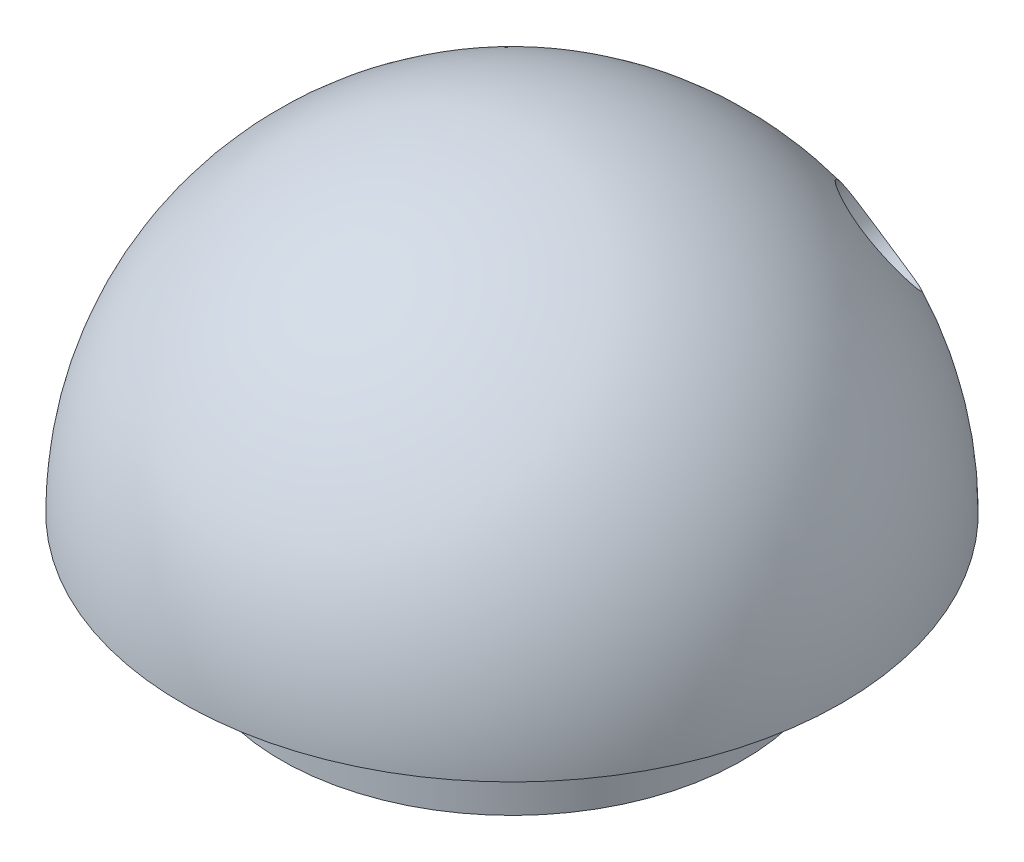
from build123d import *

# Parameters (mm, degrees)
SKETCH2_R          = 3.75
CUT_EXTRUDE1_DEPTH = 500


with BuildPart() as part:
    # Sketch1 → Revolve1 (revolve)
    with BuildSketch(Plane.XY, mode=Mode.PRIVATE) as revolve1_sk:
        with BuildLine():
            Line((17.5, 0), (17.5, 7.5))
            Line((17.5, 7.5), (25, 7.5))
            ThreePointArc((25, 7.5), (17.67766953, 25.17766953), (0, 32.5))
            Line((0, 32.5), (0, 30))
            ThreePointArc((0, 30), (15, 24.270509831), (22.360679775, 10))
            Line((22.360679775, 10), (15, 10))
            Line((15, 10), (15, 0))
            Line((15, 0), (17.5, 0))
        make_face()
    revolve(revolve1_sk.sketch.rotate(Axis((0, 0, 0), (0, 1, 0)), 90), axis=Axis((0, 0, 0), (0, 1, 0)))

    # Sketch2 → Cut-Extrude1 (cut)
    with BuildSketch(Plane.XY):
        with Locations(Location((8.758891379, 20.589020037, 0), (0, 0, 229.536406865))):
            Circle(SKETCH2_R)
        with Locations(Location((-8.758891379, 20.589020037, 0), (0, 0, 238.427728908))):
            Circle(SKETCH2_R)
    extrude(amount=-CUT_EXTRUDE1_DEPTH, mode=Mode.SUBTRACT)


solid = part.part
